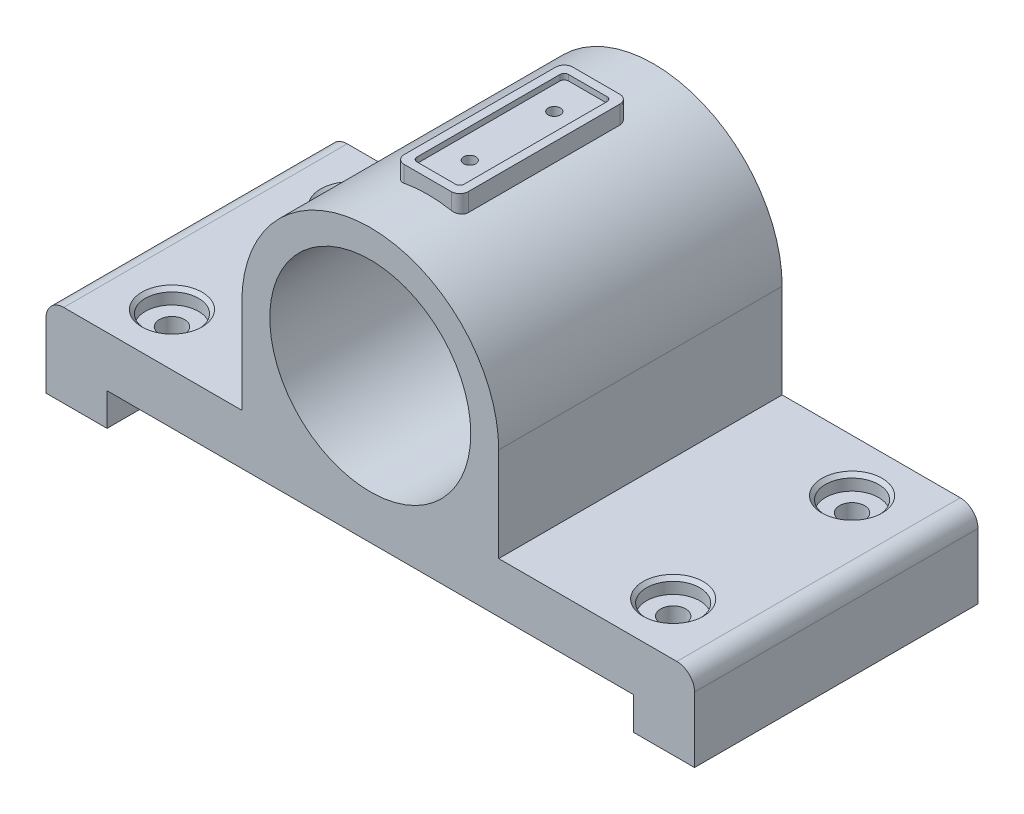
from build123d import *

# Parameters (mm, degrees)
SKETCH1_R                                   = 18.009689256
EXTRUDE1_DEPTH                              = 50.8
EXTRUDE2_REACH                              = 141.193
EXTRUDE2_END_RADIUS                         = 23.015630095
SKETCH3_OUTSIDE_W                           = 146.071
SKETCH3_OUTSIDE_H                           = 80.638
EXTRUDE3_DEPTH                              = 1.016
F_2_64_TAPPED_HOLE1_D                       = 1.778
F_2_64_TAPPED_HOLE1_DEPTH                   = 5.588
F_2_64_TAPPED_HOLE1_CBORE_D                 = 2.1844
F_2_64_TAPPED_HOLE1_CBORE_DEPTH             = 4.318
F_2_64_TAPPED_HOLE1_TIP                     = 0.53416509
CBORE_FOR_8_BINDING_HEAD_MACHINE_SC_2_COUNT = 2
CBORE_FOR_8_BINDING_HEAD_MACHINE_SC_2_PITCH = 32.054466339
CBORE_FOR_8_BINDING_HEAD_MACHINE_SC_3_COUNT = 2
CBORE_FOR_8_BINDING_HEAD_MACHINE_SC_3_PITCH = 89.830079482
CBORE_FOR_8_BINDING_HEAD_MACHINE_SC_4_COUNT = 2
CBORE_FOR_8_BINDING_HEAD_MACHINE_SC_4_PITCH = 95.377838055


with BuildPart() as part:
    # Sketch1 → Extrude1 (new body)
    with BuildSketch(Plane.XY):
        with BuildLine():
            Line((81.131890127, 9.040147783), (113.057520064, 9.040147783))
            ThreePointArc((113.057520064, 9.040147783), (115.302584094, 8.110211814), (116.232520064, 5.865147783))
            Line((116.232520064, 5.865147783), (116.232520064, 0))
            Line((116.232520064, 0), (116.232520064, -5.849507389))
            Line((116.232520064, -5.849507389), (105.291133005, -5.849507389))
            Line((105.291133005, -5.849507389), (105.291133005, 0))
            Line((105.291133005, 0), (10.941387059, 0))
            Line((10.941387059, 0), (10.941387059, -5.849507389))
            Line((10.941387059, -5.849507389), (0, -5.849507389))
            Line((0, -5.849507389), (0, 0))
            Line((0, 0), (0, 5.865147783))
            ThreePointArc((0, 5.865147783), (0.92993597, 8.110211814), (3.175, 9.040147783))
            Line((3.175, 9.040147783), (35.100629937, 9.040147783))
            Line((35.100629937, 9.040147783), (35.100629937, 25.900492611))
            ThreePointArc((35.100629937, 25.900492611), (58.116260032, 48.916122706), (81.131890127, 25.900492611))
            Line((81.131890127, 25.900492611), (81.131890127, 9.040147783))
        make_face()
        with Locations((58.116260032, 25.900492611)):
            Circle(SKETCH1_R, mode=Mode.SUBTRACT)
    extrude(amount=-EXTRUDE1_DEPTH)

    # Extrude2: up to this cylinder (the profile starts outside it)
    extrude2_end = Plane(origin=(58.116260032, 25.900492611, -25.4), z_dir=(0, 0, 1)) * Cylinder(EXTRUDE2_END_RADIUS, 329.41726019, mode=Mode.PRIVATE)
    # Sketch2 → Extrude2 (add, up to the surface)
    with BuildSketch(Plane(origin=(0, 51.456122706, 0), x_dir=(-1, 0, 0), z_dir=(0, 1, 0)), mode=Mode.PRIVATE) as extrude2_sk1:
        with BuildLine():
            Line((-62.33707365, -10.295164467), (-53.895446414, -10.295164467))
            ThreePointArc((-53.895446414, -10.295164467), (-52.81781568, -10.741533732), (-52.371446414, -11.819164467))
            Line((-52.371446414, -11.819164467), (-52.371446414, -38.980835533))
            ThreePointArc((-52.371446414, -38.980835533), (-52.81781568, -40.058466268), (-53.895446414, -40.504835533))
            Line((-53.895446414, -40.504835533), (-62.33707365, -40.504835533))
            ThreePointArc((-62.33707365, -40.504835533), (-63.414704384, -40.058466268), (-63.86107365, -38.980835533))
            Line((-63.86107365, -38.980835533), (-63.86107365, -11.819164467))
            ThreePointArc((-63.86107365, -11.819164467), (-63.414704384, -10.741533732), (-62.33707365, -10.295164467))
        make_face()
    extrude2_tool1 = extrude(extrude2_sk1.sketch, amount=-EXTRUDE2_REACH, mode=Mode.PRIVATE) - extrude2_end
    add(extrude2_tool1.solids().sort_by_distance((58.11626, 51.456123, -25.4))[0])

    # Sketch3 outside → Extrude3 (cut)
    # profile 1 of 2: a face of its own
    with BuildSketch(Plane(origin=(0, 51.456122706, 0), x_dir=(-1, 0, 0), z_dir=(0, 1, 0))):
        with Locations((-58.1165, -25.4)):
            Rectangle(SKETCH3_OUTSIDE_W, SKETCH3_OUTSIDE_H)
        with BuildLine():
            Line((-63.86107365, -11.819164467), (-63.86107365, -38.980835533))
            ThreePointArc((-63.86107365, -38.980835533), (-63.414704384, -40.058466268), (-62.33707365, -40.504835533))
            Line((-62.33707365, -40.504835533), (-53.895446414, -40.504835533))
            ThreePointArc((-53.895446414, -40.504835533), (-52.81781568, -40.058466268), (-52.371446414, -38.980835533))
            Line((-52.371446414, -38.980835533), (-52.371446414, -11.819164467))
            ThreePointArc((-52.371446414, -11.819164467), (-52.81781568, -10.741533732), (-53.895446414, -10.295164467))
            Line((-53.895446414, -10.295164467), (-62.33707365, -10.295164467))
            ThreePointArc((-62.33707365, -10.295164467), (-63.414704384, -10.741533732), (-63.86107365, -11.819164467))
        make_face(mode=Mode.SUBTRACT)
    # profile 2 of 2: a face of its own
    with BuildSketch(Plane(origin=(0, 51.456122706, 0), x_dir=(-1, 0, 0), z_dir=(0, 1, 0))):
        with BuildLine():
            Line((-54.657446414, -11.819164467), (-61.57507365, -11.819164467))
            ThreePointArc((-61.57507365, -11.819164467), (-62.113889017, -12.0423491), (-62.33707365, -12.581164467))
            Line((-62.33707365, -12.581164467), (-62.33707365, -38.218835533))
            ThreePointArc((-62.33707365, -38.218835533), (-62.113889017, -38.7576509), (-61.57507365, -38.980835533))
            Line((-61.57507365, -38.980835533), (-54.657446414, -38.980835533))
            ThreePointArc((-54.657446414, -38.980835533), (-54.118631047, -38.7576509), (-53.895446414, -38.218835533))
            Line((-53.895446414, -38.218835533), (-53.895446414, -12.581164467))
            ThreePointArc((-53.895446414, -12.581164467), (-54.118631047, -12.0423491), (-54.657446414, -11.819164467))
        make_face()
    extrude(amount=-EXTRUDE3_DEPTH, mode=Mode.SUBTRACT)

    # #2-64 Tapped Hole1
    with Locations(Plane(origin=(0, 50.440122706, 0), x_dir=(-1, 0, 0), z_dir=(0, 1, 0))):
        with Locations((-58.116260032, -17.825633593), (-58.116260032, -32.974366407)):
            CounterBoreHole(F_2_64_TAPPED_HOLE1_D / 2, F_2_64_TAPPED_HOLE1_CBORE_D / 2, F_2_64_TAPPED_HOLE1_CBORE_DEPTH, depth=F_2_64_TAPPED_HOLE1_DEPTH)
            with Locations((0, 0, -(F_2_64_TAPPED_HOLE1_DEPTH + F_2_64_TAPPED_HOLE1_TIP / 2))):  # 118° drill point
                Cone(0, F_2_64_TAPPED_HOLE1_D / 2, F_2_64_TAPPED_HOLE1_TIP, mode=Mode.SUBTRACT)

    # Sketch8 → CBORE for #8 Binding Head Machine Screw1 (revolve, cut)
    with BuildSketch(Plane(origin=(103.031299773, 9.040147783, -9.372766831), x_dir=(0, 0, 1), z_dir=(1, 0, 0))):
        Polygon((0, 0), (0, 14.889655172), (2.2479, 14.889655172), (2.2479, 2.667), (4.7625, 2.667), (4.7625, 0.635), (5.3975, 0), align=None)
    cbore_for_8_binding_head_machine_screw1 = revolve(axis=Axis((103.031299773, 15.390147783, -9.372766831), (0, -1, 0)), mode=Mode.SUBTRACT)

    # CBORE for _8 Binding Head Machine Sc 2: CBORE for #8 Binding Head Machine Screw1 ×2
    with Locations(*[(0, 0, -i * CBORE_FOR_8_BINDING_HEAD_MACHINE_SC_2_PITCH) for i in range(1, CBORE_FOR_8_BINDING_HEAD_MACHINE_SC_2_COUNT)]):
        add(cbore_for_8_binding_head_machine_screw1, mode=Mode.SUBTRACT)

    # CBORE for _8 Binding Head Machine Sc 3: CBORE for #8 Binding Head Machine Screw1 ×2
    with Locations(*[(-i * CBORE_FOR_8_BINDING_HEAD_MACHINE_SC_3_PITCH, 0, 0) for i in range(1, CBORE_FOR_8_BINDING_HEAD_MACHINE_SC_3_COUNT)]):
        add(cbore_for_8_binding_head_machine_screw1, mode=Mode.SUBTRACT)

    # CBORE for _8 Binding Head Machine Sc 4: CBORE for #8 Binding Head Machine Screw1 ×2
    with Locations(*[Vector(-0.941833882106029, 0, -0.33607876832237826) * (i * CBORE_FOR_8_BINDING_HEAD_MACHINE_SC_4_PITCH) for i in range(1, CBORE_FOR_8_BINDING_HEAD_MACHINE_SC_4_COUNT)]):
        add(cbore_for_8_binding_head_machine_screw1, mode=Mode.SUBTRACT)


solid = part.part
